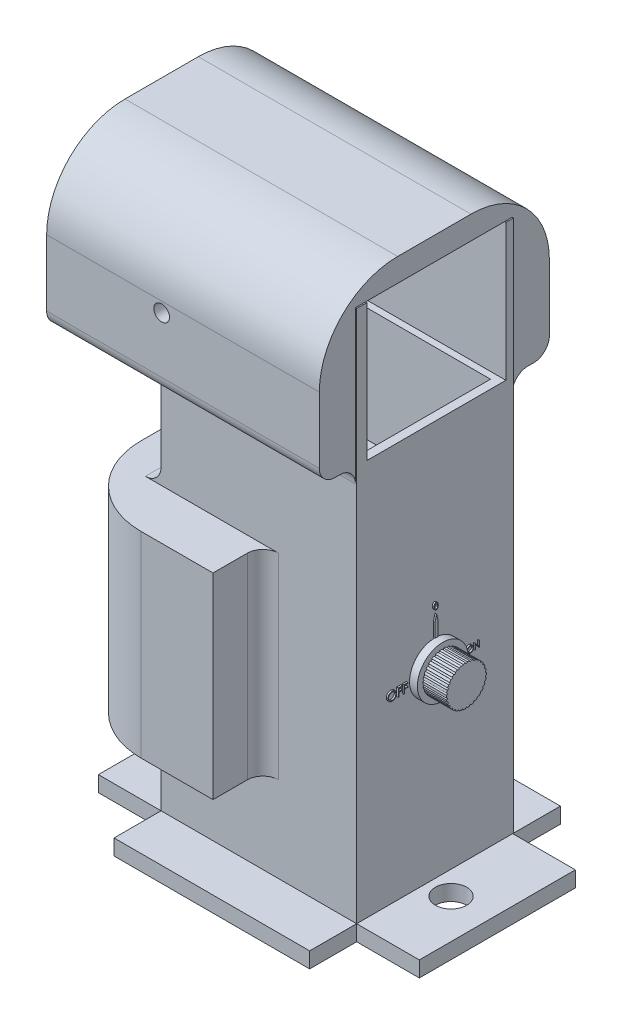
from build123d import *

# Parameters (mm, degrees)
SKETCH1_W                = 124.79
SKETCH1_H                = 100
BOSS_EXTRUDE1_DEPTH      = 350
SKETCH2_W                = 124.79
SKETCH2_H                = 10
BOSS_EXTRUDE2_DEPTH      = 30
SKETCH3_W                = 124.79
SKETCH3_H                = 10
BOSS_EXTRUDE3_DEPTH      = 30
SKETCH6_W                = 99.553967368
SKETCH6_H                = 10
BOSS_EXTRUDE4_DEPTH      = 40
SKETCH7_W                = 100
SKETCH7_H                = 10
BOSS_EXTRUDE5_DEPTH      = 40
SKETCH8_R                = 10
CUT_EXTRUDE3_DEPTH       = 40
SKETCH10_R               = 10
CUT_EXTRUDE5_DEPTH       = 10
SKETCH11_W               = 88.593263186
SKETCH11_H               = 87.312813162
CUT_EXTRUDE6_DEPTH       = 147
SKETCH12_R               = 10
CUT_EXTRUDE7_DEPTH       = 147
SKETCH13_W               = 113.789965564
SKETCH13_H               = 81.843584858
CUT_EXTRUDE8_DEPTH       = 362
BOSS_EXTRUDE6_DEPTH      = 50
BOSS_EXTRUDE6_DEPTH_BACK = 124
FILLET1_R                = 10
FILLET2_R                = 10
SKETCH16_R               = 5
CUT_EXTRUDE9_DEPTH       = 153
FILLET4_R                = 50
FILLET5_R                = 10
BOSS_EXTRUDE7_DEPTH      = 31
BOSS_EXTRUDE7_DEPTH_BACK = 65
SKETCH18_W               = 167.203870366
SKETCH18_H               = 125.262007833
FILLET6_R                = 10
FILLET7_R                = 10
FILLET8_R                = 10
FILLET9_R                = 10
FILLET10_R               = 50
FILLET11_R               = 50
SKETCH19_R               = 4.133347546
SKETCH19_R_2             = 2.879157996
BOSS_EXTRUDE8_DEPTH      = 262.687187
SKETCH20_R               = 16.244210806
BOSS_EXTRUDE9_DEPTH      = 5
SKETCH21_R               = 12.730979281
BOSS_EXTRUDE10_DEPTH     = 15
SKETCH22_R               = 0.573400989
CUT_EXTRUDE10_DEPTH      = 15
BOSS_EXTRUDE11_DEPTH     = 1
BOSS_EXTRUDE12_DEPTH     = 1
BOSS_EXTRUDE13_DEPTH     = 1
BOSS_EXTRUDE14_DEPTH     = 1


with BuildPart() as part:
    # Sketch1 → Boss-Extrude1 (new body)
    with BuildSketch(Plane(origin=(0, 0, 0), x_dir=(1, 0, 0), z_dir=(0, 1, 0))):
        Rectangle(SKETCH1_W, SKETCH1_H)
    extrude(amount=BOSS_EXTRUDE1_DEPTH)

    # Sketch2 → Boss-Extrude2 (add)
    with BuildSketch(Plane.XY.offset(50)):
        with Locations((0, 5)):
            Rectangle(SKETCH2_W, SKETCH2_H)
    extrude(amount=BOSS_EXTRUDE2_DEPTH)

    # Sketch3 → Boss-Extrude3 (add)
    with BuildSketch(Plane(origin=(0, 0, -50), x_dir=(-1, 0, 0), z_dir=(0, 0, -1))):
        with Locations((0, 5)):
            Rectangle(SKETCH3_W, SKETCH3_H)
    extrude(amount=BOSS_EXTRUDE3_DEPTH)

    # Sketch6 → Boss-Extrude4 (add)
    with BuildSketch(Plane(origin=(62.395, 0, 0), x_dir=(0, 0, -1), z_dir=(1, 0, 0))):
        with Locations((-0.223016316, 5)):
            Rectangle(SKETCH6_W, SKETCH6_H)
    extrude(amount=BOSS_EXTRUDE4_DEPTH)

    # Sketch7 → Boss-Extrude5 (add)
    with BuildSketch(Plane.ZY.offset(62.395)):
        with Locations((0, 5)):
            Rectangle(SKETCH7_W, SKETCH7_H)
    extrude(amount=BOSS_EXTRUDE5_DEPTH)

    # Sketch8 → Cut-Extrude3 (cut)
    with BuildSketch(Plane(origin=(0, 10, 0), x_dir=(1, 0, 0), z_dir=(0, 1, 0))):
        with Locations(Location((-82.395, 0, 0), (0, 0, 270))):
            Circle(SKETCH8_R)
    extrude(amount=-CUT_EXTRUDE3_DEPTH, mode=Mode.SUBTRACT)

    # Sketch10 → Cut-Extrude5 (cut)
    with BuildSketch(Plane.XZ):
        with Locations(Location((77.326038351, 4.706353017, 0), (0, 0, 270))):
            Circle(SKETCH10_R)
    extrude(amount=-CUT_EXTRUDE5_DEPTH, mode=Mode.SUBTRACT)

    # Sketch11 → Cut-Extrude6 (cut)
    with BuildSketch(Plane.ZY.offset(62.395)):
        with Locations((-0.904986131, 306.343593419)):
            Rectangle(SKETCH11_W, SKETCH11_H)
    extrude(amount=-CUT_EXTRUDE6_DEPTH, mode=Mode.SUBTRACT)

    # Sketch12 → Cut-Extrude7 (cut)
    with BuildSketch(Plane(origin=(0, 0, -50), x_dir=(-1, 0, 0), z_dir=(0, 0, -1))):
        with Locations((0, 325.51248365)):
            Circle(SKETCH12_R)
    extrude(amount=-CUT_EXTRUDE7_DEPTH, mode=Mode.SUBTRACT)

    # Sketch13 → Cut-Extrude8 (cut)
    with BuildSketch(Plane(origin=(0, 0, 0), x_dir=(-1, 0, 0), z_dir=(0, -1, 0))):
        Rectangle(SKETCH13_W, SKETCH13_H)
    extrude(amount=-CUT_EXTRUDE8_DEPTH, mode=Mode.SUBTRACT)

    # Sketch15 → Boss-Extrude6 (add, two sides: drawn at the far end of the back side and taken through both)
    with BuildSketch(Plane.ZY.offset(62.395).offset(-BOSS_EXTRUDE6_DEPTH_BACK)):
        Polygon((73.017277454, 364.852207775), (-73.758954947, 364.852207775), (-73.758954947, 262.687186838), (-50, 262.687186838), (-50, 350), (-45.201617724, 350), (43.391645462, 350), (50, 350), (50, 262.687186838), (73.017277454, 262.687186838), align=None)
    extrude(amount=BOSS_EXTRUDE6_DEPTH + BOSS_EXTRUDE6_DEPTH_BACK)

    # Fillet1
    fillet1_edges = [part.edges().sort_by_distance(p)[0] for p in [
        (-0.395, 262.687186838, -50),
    ]]
    fillet(fillet1_edges, radius=FILLET1_R)

    # Fillet2
    fillet2_edges = [part.edges().sort_by_distance(p)[0] for p in [
        (-0.395, 262.687186838, 50),
    ]]
    fillet(fillet2_edges, radius=FILLET2_R)

    # Sketch16 → Cut-Extrude9 (cut)
    with BuildSketch(Plane.XY.offset(73.017277454)):
        with Locations(Location((-38.995795168, 308.349325658, 0), (0, 0, 270))):
            Circle(SKETCH16_R)
    extrude(amount=-CUT_EXTRUDE9_DEPTH, mode=Mode.SUBTRACT)

    # Fillet4
    fillet4_edges = [part.edges().sort_by_distance(p)[0] for p in [
        (-25.395, 364.852207775, 73.017277454),
        (-25.395, 364.852207775, -73.758954947),
    ]]
    fillet(fillet4_edges, radius=FILLET4_R)

    # Fillet5
    fillet5_edges = [part.edges().sort_by_distance(p)[0] for p in [
        (-25.395, 262.687186838, 73.017277454),
        (-25.395, 262.687186838, -73.758954947),
    ]]
    fillet(fillet5_edges, radius=FILLET5_R)

    # Sketch18 → Boss-Extrude7 (add, two sides: drawn at the far end of the back side and taken through both)
    with BuildSketch(Plane.ZY.offset(62.395).offset(-BOSS_EXTRUDE7_DEPTH_BACK)):
        with Locations((-1.734479983, 127.229219332)):
            Rectangle(SKETCH18_W, SKETCH18_H)
    extrude(amount=BOSS_EXTRUDE7_DEPTH + BOSS_EXTRUDE7_DEPTH_BACK)

    # Fillet6
    fillet6_edges = [part.edges().sort_by_distance(p)[0] for p in [
        (2.605, 127.229219332, -50),
    ]]
    fillet(fillet6_edges, radius=FILLET6_R)

    # Fillet7
    fillet7_edges = [part.edges().sort_by_distance(p)[0] for p in [
        (2.605, 127.229219332, 50),
    ]]
    fillet(fillet7_edges, radius=FILLET7_R)

    # Fillet8
    fillet8_edges = [part.edges().sort_by_distance(p)[0] for p in [
        (-62.395, 189.860223248, 0),
    ]]
    fillet(fillet8_edges, radius=FILLET8_R)

    # Fillet9
    fillet9_edges = [part.edges().sort_by_distance(p)[0] for p in [
        (-62.395, 64.598215415, 0),
    ]]
    fillet(fillet9_edges, radius=FILLET9_R)

    # Fillet10
    fillet10_edges = [part.edges().sort_by_distance(p)[0] for p in [
        (-93.395, 127.229219332, -85.336415166),
    ]]
    fillet(fillet10_edges, radius=FILLET10_R)

    # Fillet11
    fillet11_edges = [part.edges().sort_by_distance(p)[0] for p in [
        (-93.395, 127.229219332, 81.8674552),
    ]]
    fillet(fillet11_edges, radius=FILLET11_R)

    # Sketch19 → Boss-Extrude8 (add)
    with BuildSketch(Plane(origin=(0, 0, 0), x_dir=(-1, 0, 0), z_dir=(0, -1, 0))):
        with Locations((66.364301073, 0)):
            Circle(SKETCH19_R)
        with Locations((66.364301073, -15.275834919)):
            Circle(SKETCH19_R)
        with Locations(Location((66.364301073, -7.85644351, 0), (0, 0, 90))):
            Circle(SKETCH19_R_2)
    extrude(amount=-BOSS_EXTRUDE8_DEPTH)

    # Sketch20 → Boss-Extrude9 (add)
    with BuildSketch(Plane(origin=(62.395, 0, 0), x_dir=(0, 0, -1), z_dir=(1, 0, 0))):
        with Locations(Location((0, 126.791185281, 0), (0, 0, 180))):
            Circle(SKETCH20_R)
    extrude(amount=BOSS_EXTRUDE9_DEPTH)

    # Sketch21 → Boss-Extrude10 (add)
    with BuildSketch(Plane(origin=(67.395, 0, 0), x_dir=(0, 0, -1), z_dir=(1, 0, 0))):
        with Locations((0, 126.791185281)):
            Circle(SKETCH21_R)
    extrude(amount=BOSS_EXTRUDE10_DEPTH)

    # Sketch22 → Cut-Extrude10 (cut)
    with BuildSketch(Plane(origin=(82.395, 0, 0), x_dir=(0, 0, -1), z_dir=(1, 0, 0))):
        with Locations((0, 139.522164562)):
            Circle(SKETCH22_R)
        with Locations((2.646919428, 139.24396212)):
            Circle(SKETCH22_R)
        with Locations((5.178155776, 138.421513574)):
            Circle(SKETCH22_R)
        with Locations((7.483081869, 137.090763874)):
            Circle(SKETCH22_R)
        with Locations((9.460961376, 135.309873167)):
            Circle(SKETCH22_R)
        with Locations((11.025351472, 133.156674921)):
            Circle(SKETCH22_R)
        with Locations((12.107880804, 130.725274234)):
            Circle(SKETCH22_R)
        with Locations((12.661237644, 128.121934981)):
            Circle(SKETCH22_R)
        with Locations((12.661237644, 125.460435581)):
            Circle(SKETCH22_R)
        with Locations((12.107880804, 122.857096328)):
            Circle(SKETCH22_R)
        with Locations((11.025351472, 120.425695641)):
            Circle(SKETCH22_R)
        with Locations((9.460961376, 118.272497395)):
            Circle(SKETCH22_R)
        with Locations((7.483081869, 116.491606688)):
            Circle(SKETCH22_R)
        with Locations((5.178155776, 115.160856988)):
            Circle(SKETCH22_R)
        with Locations((2.646919428, 114.338408443)):
            Circle(SKETCH22_R)
        with Locations((0, 114.060206)):
            Circle(SKETCH22_R)
        with Locations((-2.646919428, 114.338408443)):
            Circle(SKETCH22_R)
        with Locations((-5.178155776, 115.160856988)):
            Circle(SKETCH22_R)
        with Locations((-7.483081869, 116.491606688)):
            Circle(SKETCH22_R)
        with Locations((-9.460961376, 118.272497395)):
            Circle(SKETCH22_R)
        with Locations((-11.025351472, 120.425695641)):
            Circle(SKETCH22_R)
        with Locations((-12.107880804, 122.857096328)):
            Circle(SKETCH22_R)
        with Locations((-12.661237644, 125.460435581)):
            Circle(SKETCH22_R)
        with Locations((-12.661237644, 128.121934981)):
            Circle(SKETCH22_R)
        with Locations((-12.107880804, 130.725274234)):
            Circle(SKETCH22_R)
        with Locations((-11.025351472, 133.156674921)):
            Circle(SKETCH22_R)
        with Locations((-9.460961376, 135.309873167)):
            Circle(SKETCH22_R)
        with Locations((-7.483081869, 137.090763874)):
            Circle(SKETCH22_R)
        with Locations((-5.178155776, 138.421513574)):
            Circle(SKETCH22_R)
        with Locations((-2.646919428, 139.24396212)):
            Circle(SKETCH22_R)
    extrude(amount=-CUT_EXTRUDE10_DEPTH, mode=Mode.SUBTRACT)

    # Sketch23 → Boss-Extrude11 (add)
    # profile 1 of 3: a face of its own
    with BuildSketch(Plane(origin=(62.395, 0, 0), x_dir=(0, 0, -1), z_dir=(1, 0, 0))):
        with BuildLine():
            add(Edge.make_bspline(
                [(-28.319825379, 128.146096656), (-28.221841695, 128.143614896), (-28.029393656, 128.138740514), (-27.746554227, 128.101428059), (-27.476535452, 128.036876696), (-27.217137743, 127.950905282), (-26.971463838, 127.836220676), (-26.73766456, 127.697601463), (-26.516296191, 127.533595389), (-26.310342435, 127.345470248), (-26.121872999, 127.140783359), (-25.955826718, 126.922346519), (-25.816667536, 126.691480473), (-25.702389025, 126.448878979), (-25.612735174, 126.195090694), (-25.550869477, 125.928762618), (-25.511351083, 125.651620361), (-25.506731039, 125.462591649), (-25.504387345, 125.366699621)],
                knots=[0, 0, 0, 0, 1.065120563, 2.091984664, 3.0946048, 4.079830382, 5.057816894, 6.036188127, 7.030412546, 8.04752943, 9.064399622, 10.05169764, 11.02544977, 11.989514704, 12.962713494, 13.945757189, 14.957906945, 16, 16, 16, 16], degree=3))
            add(Edge.make_bspline(
                [(-25.504387345, 125.366699621), (-25.506730696, 125.271513958), (-25.511349711, 125.083891989), (-25.55091441, 124.808508449), (-25.612964493, 124.543787991), (-25.701556467, 124.29017254), (-25.815290226, 124.047394556), (-25.955376021, 123.816092852), (-26.120387137, 123.596191599), (-26.308176067, 123.390099831), (-26.512889547, 123.20111556), (-26.732463879, 123.036440593), (-26.961960922, 122.894738643), (-27.204333933, 122.78167285), (-27.456368513, 122.691303399), (-27.720320358, 122.629689304), (-27.994952648, 122.589945798), (-28.182233809, 122.585382089), (-28.277424204, 122.583062468)],
                knots=[0, 0, 0, 0, 1.043624062, 2.057103931, 3.04512605, 4.022047818, 4.998200453, 5.980619268, 6.982898556, 8.009068085, 9.034988726, 10.034168286, 11.015286542, 11.987931943, 12.962482838, 13.94673481, 14.956375938, 16, 16, 16, 16], degree=3))
            add(Edge.make_bspline(
                [(-28.277424204, 122.583062468), (-28.373315734, 122.585404994), (-28.562343465, 122.590022735), (-28.839833983, 122.629606525), (-29.106349143, 122.691505878), (-29.361126794, 122.779966573), (-29.604309008, 122.894292624), (-29.836371395, 123.033696864), (-30.056382487, 123.199110042), (-30.262518223, 123.386838077), (-30.45112713, 123.59120459), (-30.615560948, 123.81018019), (-30.754996536, 124.039468797), (-30.868938717, 124.27970672), (-30.959145697, 124.529732592), (-31.020687505, 124.791214219), (-31.060504957, 125.062660853), (-31.065093356, 125.247480473), (-31.067421533, 125.341258916)],
                knots=[0, 0, 0, 0, 1.053102029, 2.075944431, 3.073151272, 4.055350789, 5.033113405, 6.020478099, 7.024410459, 8.052272461, 9.079885166, 10.07527673, 11.055994387, 12.023226415, 12.992069828, 13.970394897, 14.97016774, 16, 16, 16, 16], degree=3))
            add(Edge.make_bspline(
                [(-31.067421533, 125.341258916), (-31.066613215, 125.404203547), (-31.065006777, 125.529298734), (-31.045666956, 125.715061331), (-31.017603431, 125.897836493), (-30.977383873, 126.077104473), (-30.924782186, 126.252426438), (-30.862715431, 126.42501152), (-30.78690876, 126.593110722), (-30.701213018, 126.757520373), (-30.605567189, 126.915677564), (-30.499921711, 127.065174077), (-30.387987285, 127.207264394), (-30.265275963, 127.338266411), (-30.135832052, 127.461991106), (-29.997555695, 127.576537119), (-29.851290635, 127.682937342), (-29.696407513, 127.778822858), (-29.53672274, 127.865544407), (-29.372111421, 127.939963157), (-29.204809224, 128.003835179), (-29.034032554, 128.055604046), (-28.86023491, 128.09647391), (-28.683036974, 128.124304075), (-28.502579913, 128.143693223), (-28.381005657, 128.145292065), (-28.319825379, 128.146096656)],
                knots=[0, 0, 0, 0, 1.037015668, 2.060948919, 3.074880161, 4.083647147, 5.086022904, 6.090072063, 7.104153813, 8.122640571, 9.144368836, 10.147691507, 11.138137339, 12.123020368, 13.103399296, 14.087645067, 15.080126199, 16.082011238, 17.087798457, 18.072939717, 19.057185487, 20.037253025, 21.01195951, 21.997135196, 22.992090687, 24, 24, 24, 24], degree=3))
        make_face()
        with BuildLine():
            add(Edge.make_bspline(
                [(-28.296504733, 127.603361614), (-28.346722096, 127.602749458), (-28.44667674, 127.601530999), (-28.595273598, 127.585481049), (-28.741916165, 127.562606097), (-28.886634724, 127.529976893), (-29.028823757, 127.485520766), (-29.169808636, 127.434356536), (-29.308303729, 127.372034173), (-29.443851824, 127.301620679), (-29.57525914, 127.22368362), (-29.699254533, 127.137547734), (-29.816159007, 127.045233015), (-29.925686327, 126.946524023), (-30.027514885, 126.840918078), (-30.123648898, 126.73001618), (-30.210235051, 126.61064844), (-30.289588245, 126.486051754), (-30.360599146, 126.356388411), (-30.423744385, 126.2230235), (-30.475397112, 126.08486914), (-30.517522372, 125.943424164), (-30.552447086, 125.798912588), (-30.574572185, 125.65023815), (-30.59079849, 125.498147921), (-30.591947304, 125.395365832), (-30.592528371, 125.343378975)],
                knots=[0, 0, 0, 0, 1.008559885, 2.007477868, 2.99961109, 3.989939068, 4.984837346, 5.991145699, 7.001802488, 8.033829008, 9.059044045, 10.069351652, 11.065060232, 12.050310815, 13.029377138, 14.011219647, 14.996725999, 15.989392538, 16.977580475, 17.965360261, 18.951710183, 19.937753436, 20.929683414, 21.935841486, 22.955955122, 24, 24, 24, 24], degree=3))
            add(Edge.make_bspline(
                [(-30.592528371, 125.343378975), (-30.590600901, 125.266933712), (-30.586808972, 125.116542232), (-30.553611217, 124.896154681), (-30.502475612, 124.684354534), (-30.427096023, 124.482300695), (-30.332827832, 124.288256363), (-30.216370509, 124.103942919), (-30.078395463, 123.929310549), (-29.921666084, 123.765578416), (-29.750332944, 123.616132974), (-29.568401317, 123.484954963), (-29.377820267, 123.373965657), (-29.178092806, 123.283546083), (-28.970285217, 123.211897313), (-28.753058444, 123.162792716), (-28.527859534, 123.130475063), (-28.374354853, 123.127371492), (-28.296504733, 123.125797511)],
                knots=[0, 0, 0, 0, 1.032063989, 2.030389145, 3.003944642, 3.970395727, 4.937377036, 5.913328081, 6.909231446, 7.93887556, 8.970685674, 9.976071282, 10.964166581, 11.944589148, 12.933237628, 13.927779006, 14.949070134, 16, 16, 16, 16], degree=3))
            add(Edge.make_bspline(
                [(-28.296504733, 123.125797511), (-28.244178463, 123.126516428), (-28.140399753, 123.127942257), (-27.986041047, 123.142303352), (-27.834463203, 123.165332488), (-27.685878827, 123.198489551), (-27.540456553, 123.239987113), (-27.39758941, 123.289286892), (-27.258799138, 123.350792998), (-27.122334859, 123.41875002), (-26.99171197, 123.496220258), (-26.86701682, 123.579432698), (-26.751392422, 123.671611446), (-26.64194704, 123.768853853), (-26.539700415, 123.873120623), (-26.445343975, 123.984276197), (-26.359195441, 124.103022191), (-26.27987238, 124.227429887), (-26.209110305, 124.357448031), (-26.147456191, 124.491296473), (-26.095150158, 124.628645626), (-26.052924919, 124.769693598), (-26.019836185, 124.9141725), (-25.997036782, 125.062275785), (-25.981088548, 125.213707172), (-25.979886467, 125.31612943), (-25.979280508, 125.367759651)],
                knots=[0, 0, 0, 0, 1.047197238, 2.076906641, 3.100256066, 4.114471768, 5.12198147, 6.126382909, 7.136867548, 8.15857795, 9.17633901, 10.174870724, 11.156907918, 12.133735059, 13.104061851, 14.077631395, 15.04955518, 16.038496417, 17.029181396, 18.010275684, 18.986308667, 19.968651475, 20.955262928, 21.950658345, 22.966943676, 24, 24, 24, 24], degree=3))
            add(Edge.make_bspline(
                [(-25.979280508, 125.367759651), (-25.979886952, 125.419036663), (-25.981089947, 125.520754063), (-25.997029164, 125.671129348), (-26.019860273, 125.818166941), (-26.052763414, 125.961289596), (-26.095172575, 126.100533794), (-26.147465325, 126.235768758), (-26.209128813, 126.367498291), (-26.279898391, 126.495396812), (-26.359448505, 126.618125284), (-26.446374325, 126.735452741), (-26.542176697, 126.845175815), (-26.644118425, 126.950003269), (-26.754745835, 127.047699364), (-26.873557803, 127.138296508), (-26.999111935, 127.223981101), (-27.132049541, 127.301278082), (-27.269245757, 127.372661505), (-27.410025193, 127.433819569), (-27.552792999, 127.48578694), (-27.697186121, 127.530111399), (-27.844419909, 127.562478302), (-27.993499508, 127.585501663), (-28.144218661, 127.601525413), (-28.245581624, 127.602747605), (-28.296504733, 127.603361614)],
                knots=[0, 0, 0, 0, 1.02996197, 2.043119294, 3.035359645, 4.018872909, 4.991431989, 5.957985074, 6.929999688, 7.912076566, 8.892894881, 9.867085534, 10.843653904, 11.817741046, 12.803660682, 13.806313499, 14.818574707, 15.856120519, 16.894564902, 17.924820532, 18.937903209, 19.946497019, 20.957711757, 21.963978472, 22.977135795, 24, 24, 24, 24], degree=3))
        make_face(mode=Mode.SUBTRACT)
    # profile 2 of 3: a face of its own
    with BuildSketch(Plane(origin=(62.395, 0, 0), x_dir=(0, 0, -1), z_dir=(1, 0, 0))):
        Polygon((-24.41891726, 128.010412896), (-21.840925807, 128.010412896), (-21.840925807, 127.467677853), (-23.944024097, 127.467677853), (-23.944024097, 125.839472725), (-21.840925807, 125.839472725), (-21.840925807, 125.296737682), (-23.944024097, 125.296737682), (-23.944024097, 122.718746229), (-24.41891726, 122.718746229), align=None)
    # profile 3 of 3: a face of its own
    with BuildSketch(Plane(origin=(62.395, 0, 0), x_dir=(0, 0, -1), z_dir=(1, 0, 0))):
        Polygon((-20.891139482, 128.010412896), (-18.313148029, 128.010412896), (-18.313148029, 127.467677853), (-20.41624632, 127.467677853), (-20.41624632, 125.839472725), (-18.313148029, 125.839472725), (-18.313148029, 125.296737682), (-20.41624632, 125.296737682), (-20.41624632, 122.718746229), (-20.891139482, 122.718746229), align=None)
    extrude(amount=BOSS_EXTRUDE11_DEPTH)

    # Sketch24 → Boss-Extrude12 (add)
    # profile 1 of 2: a face of its own
    with BuildSketch(Plane(origin=(62.395, 0, 0), x_dir=(0, 0, -1), z_dir=(1, 0, 0))):
        with BuildLine():
            add(Edge.make_bspline(
                [(21.540410624, 128.443196758), (21.613898387, 128.441335438), (21.758234417, 128.437679651), (21.970363988, 128.409695311), (22.172878069, 128.361281788), (22.367426352, 128.296803228), (22.55168178, 128.210789773), (22.727031239, 128.106825363), (22.893057515, 127.983820807), (23.047522832, 127.842726952), (23.18887491, 127.689211786), (23.31340962, 127.525384155), (23.417779007, 127.352234621), (23.50348789, 127.1702835), (23.570728278, 126.979942286), (23.617127551, 126.78019623), (23.646766346, 126.572339537), (23.650231379, 126.430568002), (23.65198915, 126.358648982)],
                knots=[0, 0, 0, 0, 1.065120563, 2.091984664, 3.0946048, 4.079830382, 5.057816894, 6.036188127, 7.030412546, 8.04752943, 9.064399622, 10.05169764, 11.02544977, 11.989514704, 12.962713494, 13.945757189, 14.957906945, 16, 16, 16, 16], degree=3))
            add(Edge.make_bspline(
                [(23.65198915, 126.358648982), (23.650231637, 126.287259735), (23.646767376, 126.146543258), (23.617093851, 125.940005602), (23.570556289, 125.741465259), (23.504112308, 125.551253671), (23.418811989, 125.369170183), (23.313747643, 125.195693905), (23.189989306, 125.030767965), (23.049147609, 124.876199139), (22.895612499, 124.734460936), (22.73093175, 124.610954711), (22.558808967, 124.504678248), (22.377029209, 124.419878904), (22.188003274, 124.352101815), (21.99003939, 124.305891244), (21.784065173, 124.276083614), (21.643604302, 124.272660833), (21.572211505, 124.270921117)],
                knots=[0, 0, 0, 0, 1.043624062, 2.057103931, 3.04512605, 4.022047818, 4.998200453, 5.980619268, 6.982898556, 8.009068085, 9.034988726, 10.034168286, 11.015286542, 11.987931943, 12.962482838, 13.94673481, 14.956375938, 16, 16, 16, 16], degree=3))
            add(Edge.make_bspline(
                [(21.572211505, 124.270921117), (21.500292858, 124.272678011), (21.35852206, 124.276141317), (21.150404171, 124.30582916), (20.950517801, 124.352253674), (20.759434564, 124.418599196), (20.577047902, 124.504343734), (20.403001112, 124.608896914), (20.237992793, 124.732956797), (20.083390992, 124.873752824), (19.941934311, 125.027027709), (19.818608948, 125.191259409), (19.714032257, 125.363225864), (19.628575621, 125.543404306), (19.560920386, 125.73092371), (19.51476403, 125.92703493), (19.484900941, 126.130619905), (19.481459642, 126.269234621), (19.479713509, 126.339568453)],
                knots=[0, 0, 0, 0, 1.053102029, 2.075944431, 3.073151272, 4.055350789, 5.033113405, 6.020478099, 7.024410459, 8.052272461, 9.079885166, 10.07527673, 11.055994387, 12.023226415, 12.992069828, 13.970394897, 14.97016774, 16, 16, 16, 16], degree=3))
            add(Edge.make_bspline(
                [(19.479713509, 126.339568453), (19.480319747, 126.386776926), (19.481524576, 126.480598316), (19.496029442, 126.619920264), (19.517077085, 126.757001635), (19.547241754, 126.891452621), (19.586693019, 127.022944095), (19.633243086, 127.152382906), (19.690098089, 127.278457307), (19.754369895, 127.401764546), (19.826104267, 127.520382439), (19.905338376, 127.632504824), (19.989289195, 127.739072561), (20.081322686, 127.837324074), (20.17840562, 127.930117595), (20.282112888, 128.016027105), (20.391811683, 128.095827273), (20.507974024, 128.167741409), (20.627737603, 128.232782571), (20.751196093, 128.288596634), (20.876672741, 128.33650065), (21.004755243, 128.3753273), (21.135103476, 128.405979698), (21.268001928, 128.426852322), (21.403344724, 128.441394183), (21.494525416, 128.442593315), (21.540410624, 128.443196758)],
                knots=[0, 0, 0, 0, 1.037015668, 2.060948919, 3.074880161, 4.083647147, 5.086022904, 6.090072063, 7.104153813, 8.122640571, 9.144368836, 10.147691507, 11.138137339, 12.123020368, 13.103399296, 14.087645067, 15.080126199, 16.082011238, 17.087798457, 18.072939717, 19.057185487, 20.037253025, 21.01195951, 21.997135196, 22.992090687, 24, 24, 24, 24], degree=3))
        make_face()
        with BuildLine():
            add(Edge.make_bspline(
                [(21.557901109, 128.036145476), (21.520238087, 128.03568636), (21.445272104, 128.034772516), (21.33382446, 128.022735052), (21.223842535, 128.005578839), (21.115303616, 127.981106936), (21.008661841, 127.94776484), (20.902923182, 127.909391668), (20.799051862, 127.862649895), (20.697390791, 127.809839775), (20.598835304, 127.751386981), (20.505838759, 127.686785067), (20.418160403, 127.617549028), (20.336014913, 127.543517283), (20.259643495, 127.464312824), (20.187542985, 127.381136401), (20.12260337, 127.291610596), (20.063088475, 127.198163081), (20.009830299, 127.100915574), (19.96247137, 127.000891891), (19.923731825, 126.897276121), (19.89213788, 126.791192389), (19.865944344, 126.682808707), (19.84935052, 126.571302878), (19.837180791, 126.457235206), (19.83631918, 126.38014864), (19.83588338, 126.341158497)],
                knots=[0, 0, 0, 0, 1.008559885, 2.007477868, 2.99961109, 3.989939068, 4.984837346, 5.991145699, 7.001802488, 8.033829008, 9.059044045, 10.069351652, 11.065060232, 12.050310815, 13.029377138, 14.011219647, 14.996725999, 15.989392538, 16.977580475, 17.965360261, 18.951710183, 19.937753436, 20.929683414, 21.935841486, 22.955955122, 24, 24, 24, 24], degree=3))
            add(Edge.make_bspline(
                [(19.83588338, 126.341158497), (19.837328983, 126.28382455), (19.84017293, 126.17103094), (19.865071246, 126.005740277), (19.903422949, 125.846890167), (19.959957642, 125.695349787), (20.030658785, 125.549816538), (20.118001777, 125.411581455), (20.221483061, 125.280607178), (20.339030096, 125.157808078), (20.467529951, 125.045723997), (20.603978671, 124.947340489), (20.746914458, 124.864098509), (20.896710054, 124.796283829), (21.052565746, 124.742547251), (21.215485826, 124.705718803), (21.384385008, 124.681480563), (21.499513519, 124.679152885), (21.557901109, 124.677972399)],
                knots=[0, 0, 0, 0, 1.032063989, 2.030389145, 3.003944642, 3.970395727, 4.937377036, 5.913328081, 6.909231446, 7.93887556, 8.970685674, 9.976071282, 10.964166581, 11.944589148, 12.933237628, 13.927779006, 14.949070134, 16, 16, 16, 16], degree=3))
            add(Edge.make_bspline(
                [(21.557901109, 124.677972399), (21.597145812, 124.678511587), (21.674979844, 124.679580959), (21.790748874, 124.69035178), (21.904432257, 124.707623632), (22.015870538, 124.732491429), (22.124937244, 124.763614601), (22.232087601, 124.800589435), (22.336180305, 124.846719014), (22.438528514, 124.897686781), (22.536495681, 124.955789459), (22.630017044, 125.01819879), (22.716735342, 125.087332851), (22.798819379, 125.160264656), (22.875504347, 125.238464733), (22.946271678, 125.321831414), (23.010883078, 125.410890909), (23.070375373, 125.504196681), (23.12344693, 125.601710289), (23.169687516, 125.702096621), (23.20891704, 125.805108486), (23.240585969, 125.910894464), (23.26540252, 126.019253641), (23.282502072, 126.130331104), (23.294463248, 126.243904645), (23.295364809, 126.320721338), (23.295819278, 126.359444004)],
                knots=[0, 0, 0, 0, 1.047197238, 2.076906641, 3.100256066, 4.114471768, 5.12198147, 6.126382909, 7.136867548, 8.15857795, 9.17633901, 10.174870724, 11.156907918, 12.133735059, 13.104061851, 14.077631395, 15.04955518, 16.038496417, 17.029181396, 18.010275684, 18.986308667, 19.968651475, 20.955262928, 21.950658345, 22.966943676, 24, 24, 24, 24], degree=3))
            add(Edge.make_bspline(
                [(23.295819278, 126.359444004), (23.295364444, 126.397901763), (23.294462198, 126.474189813), (23.282507785, 126.586971277), (23.265384454, 126.697249472), (23.240707098, 126.804591463), (23.208900227, 126.909024612), (23.169680665, 127.010450834), (23.123433049, 127.109247984), (23.070355866, 127.205171875), (23.01069328, 127.297218229), (22.945498915, 127.385213822), (22.873647136, 127.467506127), (22.79719084, 127.546126718), (22.714220283, 127.619398789), (22.625111306, 127.687346647), (22.530945707, 127.751610092), (22.431242503, 127.809582827), (22.328345341, 127.863120395), (22.222760764, 127.908988943), (22.11568491, 127.947964471), (22.007390068, 127.981207815), (21.896964727, 128.005482992), (21.785155028, 128.022750513), (21.672115663, 128.034768326), (21.596093441, 128.035684969), (21.557901109, 128.036145476)],
                knots=[0, 0, 0, 0, 1.02996197, 2.043119294, 3.035359645, 4.018872909, 4.991431989, 5.957985074, 6.929999688, 7.912076566, 8.892894881, 9.867085534, 10.843653904, 11.817741046, 12.803660682, 13.806313499, 14.818574707, 15.856120519, 16.894564902, 17.924820532, 18.937903209, 19.946497019, 20.957711757, 21.963978472, 22.977135795, 24, 24, 24, 24], degree=3))
        make_face(mode=Mode.SUBTRACT)
    # profile 2 of 2: a face of its own
    with BuildSketch(Plane(origin=(62.395, 0, 0), x_dir=(0, 0, -1), z_dir=(1, 0, 0))):
        Polygon((24.466091714, 124.372683938), (24.466091714, 128.341433938), (24.540823785, 128.341433938), (27.162806457, 125.217792361), (27.162806457, 128.341433938), (27.518976329, 128.341433938), (27.518976329, 124.372683938), (27.437884082, 124.372683938), (24.822261586, 127.489170316), (24.822261586, 124.372683938), align=None)
    extrude(amount=BOSS_EXTRUDE12_DEPTH)

    # Sketch25 → Boss-Extrude13 (add)
    with BuildSketch(Plane(origin=(62.395, 0, 0), x_dir=(0, 0, -1), z_dir=(1, 0, 0))):
        Polygon((-0.913667338, 152.779457662), (0, 156.676509859), (0.913667338, 152.779457662), (0.913667338, 143.68633587), (-0.913667338, 143.68633587), align=None)
    extrude(amount=BOSS_EXTRUDE13_DEPTH)

    # Sketch26 → Boss-Extrude14 (add)
    with BuildSketch(Plane(origin=(62.395, 0, 0), x_dir=(0, 0, -1), z_dir=(1, 0, 0))):
        with BuildLine():
            add(Edge.make_bspline(
                [(-1.609757408, 161.089846255), (-1.609385458, 161.153456686), (-1.608662942, 161.277020864), (-1.600625179, 161.457071307), (-1.587272782, 161.625981634), (-1.568974154, 161.783759933), (-1.546706087, 161.930446933), (-1.516979597, 162.065650631), (-1.483174009, 162.189996792), (-1.443994003, 162.303890901), (-1.399784635, 162.408867403), (-1.351667215, 162.506867408), (-1.297732135, 162.597742635), (-1.241061886, 162.682943523), (-1.179362483, 162.761075391), (-1.114389747, 162.833241624), (-1.043607799, 162.89777435), (-0.96942278, 162.956564354), (-0.891163039, 163.008100808), (-0.811059302, 163.053495074), (-0.728560209, 163.092275281), (-0.643440519, 163.122767115), (-0.556465297, 163.147952628), (-0.467330498, 163.16517581), (-0.375888952, 163.176012662), (-0.314167593, 163.177048696), (-0.282865631, 163.17757412)],
                knots=[0, 0, 0, 0, 1.646270934, 3.197905019, 4.663502075, 6.030701355, 7.308322542, 8.50163776, 9.611534131, 10.641858119, 11.616356847, 12.558055219, 13.465016945, 14.349605745, 15.204443733, 16.039544428, 16.859896111, 17.680448484, 18.487036065, 19.28249412, 20.06191084, 20.843045899, 21.620316918, 22.403196591, 23.190181807, 24, 24, 24, 24], degree=3))
            add(Edge.make_bspline(
                [(-0.282865631, 163.17757412), (-0.251302186, 163.177020972), (-0.188532426, 163.175920936), (-0.095731286, 163.165348251), (-0.005074058, 163.147805102), (0.08305276, 163.122948283), (0.169373057, 163.092110328), (0.253211662, 163.053457972), (0.335089335, 163.008464971), (0.413704929, 162.955596824), (0.489921502, 162.896652636), (0.56186696, 162.830019967), (0.629547852, 162.756371625), (0.6938136, 162.676495582), (0.752840929, 162.588859817), (0.80905366, 162.494988549), (0.859368379, 162.393240158), (0.907826448, 162.285312306), (0.949653657, 162.168218693), (0.987375203, 162.042619366), (1.017854033, 161.907030779), (1.043241869, 161.762164323), (1.062909742, 161.60748798), (1.077234256, 161.443333319), (1.084801057, 161.26959234), (1.086226067, 161.150804422), (1.086957336, 161.089846255)],
                knots=[0, 0, 0, 0, 0.810914788, 1.612654377, 2.396697861, 3.181598691, 3.963628158, 4.749916497, 5.551656086, 6.361998678, 7.18212741, 8.025565596, 8.878627764, 9.750805457, 10.657531673, 11.591944965, 12.560506719, 13.57287815, 14.630710178, 15.753379473, 16.941251878, 18.199788006, 19.531962791, 20.947069417, 22.433333509, 24, 24, 24, 24], degree=3))
            add(Edge.make_bspline(
                [(1.086957336, 161.089846255), (1.086218486, 161.029153967), (1.084778866, 160.910897518), (1.077319082, 160.737938287), (1.06262492, 160.574654791), (1.044243951, 160.420655428), (1.018786163, 160.276581163), (0.987483876, 160.141933441), (0.9527286, 160.016130788), (0.909826645, 159.900203814), (0.862869858, 159.792535342), (0.811780484, 159.69199313), (0.757045949, 159.597688494), (0.697414068, 159.510376281), (0.633853501, 159.429437983), (0.565003866, 159.356302285), (0.49280597, 159.28920697), (0.416365106, 159.229503785), (0.336523436, 159.177246908), (0.254926983, 159.130513346), (0.170127968, 159.092829844), (0.084048102, 159.060473145), (-0.004543885, 159.03575299), (-0.09553756, 159.018660315), (-0.188470077, 159.006672594), (-0.251291495, 159.005758103), (-0.282865631, 159.005298479)],
                knots=[0, 0, 0, 0, 1.561518951, 3.042555995, 4.452378317, 5.7783523, 7.031515105, 8.214008947, 9.334062868, 10.386615937, 11.391082383, 12.354592575, 13.286541444, 14.194233754, 15.072674879, 15.931287219, 16.775624067, 17.606195743, 18.42308326, 19.229000347, 20.022332153, 20.807536673, 21.593273796, 22.3848459, 23.188221202, 24, 24, 24, 24], degree=3))
            add(Edge.make_bspline(
                [(-0.282865631, 159.005298479), (-0.314166724, 159.005827292), (-0.375886371, 159.00687001), (-0.467340461, 159.017657902), (-0.55610716, 159.03500191), (-0.642624497, 159.059286809), (-0.727336349, 159.089012561), (-0.809088388, 159.127740399), (-0.888789601, 159.172342424), (-0.966227348, 159.223137232), (-1.039946495, 159.281332355), (-1.110361877, 159.345699003), (-1.175704533, 159.417843407), (-1.236521766, 159.496626409), (-1.294322741, 159.581323211), (-1.347491941, 159.673090205), (-1.396671392, 159.771563523), (-1.441624279, 159.877379368), (-1.481480353, 159.992081831), (-1.516686236, 160.116983131), (-1.544483539, 160.253185683), (-1.568276712, 160.399595555), (-1.587467754, 160.556841886), (-1.600569533, 160.725010046), (-1.608667274, 160.903995238), (-1.609387399, 161.026765428), (-1.609757408, 161.089846255)],
                knots=[0, 0, 0, 0, 0.810891512, 1.598919785, 2.382837074, 3.152667961, 3.926044502, 4.706494248, 5.493654104, 6.291793342, 7.103789334, 7.925228297, 8.761435821, 9.622817696, 10.50288917, 11.416980706, 12.369136599, 13.353924996, 14.394355917, 15.514179734, 16.714354668, 17.994756427, 19.357759367, 20.818452758, 22.365282078, 24, 24, 24, 24], degree=3))
        make_face()
        with BuildLine():
            add(Edge.make_bspline(
                [(-1.253587536, 161.091436299), (-1.253452091, 161.038426614), (-1.25318922, 160.935545224), (-1.246321921, 160.786044383), (-1.236966748, 160.646604814), (-1.224900277, 160.517049465), (-1.206980862, 160.397816861), (-1.186902629, 160.288086953), (-1.162468635, 160.188440443), (-1.133559106, 160.09819355), (-1.100630844, 160.015814696), (-1.064678659, 159.939159747), (-1.026056232, 159.867323176), (-0.982831838, 159.800950245), (-0.935756722, 159.739824505), (-0.885894187, 159.682864061), (-0.83138331, 159.632067484), (-0.755972817, 159.571145068), (-0.656417886, 159.508190336), (-0.530982191, 159.453369324), (-0.402090287, 159.418917788), (-0.31460628, 159.414536565), (-0.2709403, 159.412349761)],
                knots=[0, 0, 0, 0, 1.459021318, 2.831673884, 4.118529203, 5.306027144, 6.411944654, 7.436330062, 8.375795394, 9.233974572, 10.042671642, 10.816086306, 11.563610507, 12.285937304, 12.993564865, 13.685989202, 14.367179055, 15.041617293, 16.353048772, 17.594441528, 18.799311195, 20, 20, 20, 20], degree=3))
            add(Edge.make_bspline(
                [(-0.2709403, 159.412349761), (-0.226991869, 159.41416153), (-0.139185744, 159.417781328), (-0.010900101, 159.452704896), (0.11363958, 159.505398035), (0.211239013, 159.567704581), (0.28549154, 159.627041169), (0.338692055, 159.677630993), (0.387521342, 159.734277379), (0.433833338, 159.79539533), (0.476309254, 159.862152522), (0.514934419, 159.934227942), (0.550180715, 160.011821742), (0.570261508, 160.065989214), (0.5805283, 160.093683645)],
                knots=[0, 0, 0, 0, 1.353760809, 2.704726607, 4.075137775, 5.516104923, 6.260822281, 7.007110065, 7.778089737, 8.566572457, 9.372053459, 10.217411131, 11.088608312, 12, 12, 12, 12], degree=3))
            add(Edge.make_bspline(
                [(0.5805283, 160.093683645), (0.592493251, 160.129095939), (0.616787232, 160.200998082), (0.648097012, 160.312535438), (0.672754742, 160.42956), (0.694938201, 160.55137241), (0.710079613, 160.678870999), (0.722266865, 160.811661274), (0.729445412, 160.949843354), (0.730335264, 161.04372696), (0.730787464, 161.091436299)],
                knots=[0, 0, 0, 0, 0.884706709, 1.796334032, 2.740027952, 3.714592787, 4.726048262, 5.777819803, 6.87074269, 8, 8, 8, 8], degree=3))
            add(Edge.make_bspline(
                [(0.730787464, 161.091436299), (0.730163589, 161.139137922), (0.728943156, 161.232452492), (0.724278187, 161.369111501), (0.712231813, 161.498909765), (0.698852455, 161.622406462), (0.679125249, 161.738917966), (0.657855235, 161.849419652), (0.629278861, 161.952542546), (0.598753759, 162.049901179), (0.563816971, 162.140389421), (0.525358951, 162.224429161), (0.484286064, 162.302426125), (0.439674773, 162.374166318), (0.392054668, 162.439971076), (0.340168876, 162.498521018), (0.286075525, 162.551630795), (0.210309609, 162.612253529), (0.111120012, 162.674065898), (-0.012303177, 162.730950287), (-0.140743997, 162.763616833), (-0.227572825, 162.768222496), (-0.2709403, 162.770522838)],
                knots=[0, 0, 0, 0, 1.31362396, 2.569729283, 3.763502607, 4.902122613, 5.988968491, 7.01645872, 7.998833611, 8.933434873, 9.825090667, 10.667526885, 11.477055099, 12.250526234, 12.991942729, 13.710640831, 14.402115721, 15.076753259, 16.378508321, 17.609869233, 18.806226677, 20, 20, 20, 20], degree=3))
            add(Edge.make_bspline(
                [(-0.2709403, 162.770522838), (-0.314835347, 162.768219322), (-0.402705406, 162.763608095), (-0.532481211, 162.731071995), (-0.65687811, 162.674360864), (-0.755805412, 162.612048799), (-0.83162417, 162.552700892), (-0.885012581, 162.501235895), (-0.935071187, 162.444940589), (-0.981185454, 162.383252703), (-1.024375981, 162.316957153), (-1.06404195, 162.245532393), (-1.099780351, 162.168616471), (-1.132760137, 162.08627462), (-1.161757852, 161.996035513), (-1.1856769, 161.896511744), (-1.207773826, 161.787130849), (-1.223416676, 161.667252478), (-1.237322899, 161.537664679), (-1.246259784, 161.397877006), (-1.253212192, 161.248125432), (-1.253459915, 161.1447121), (-1.253587536, 161.091436299)],
                knots=[0, 0, 0, 0, 1.207732386, 2.417664972, 3.655092373, 4.956220595, 5.625982001, 6.301752483, 6.994047911, 7.697131622, 8.419323945, 9.170223765, 9.943494443, 10.752040957, 11.610060368, 12.549350801, 13.567764191, 14.679664412, 15.874934091, 17.154273443, 18.533957287, 20, 20, 20, 20], degree=3))
        make_face(mode=Mode.SUBTRACT)
    extrude(amount=BOSS_EXTRUDE14_DEPTH)


solid = part.part
